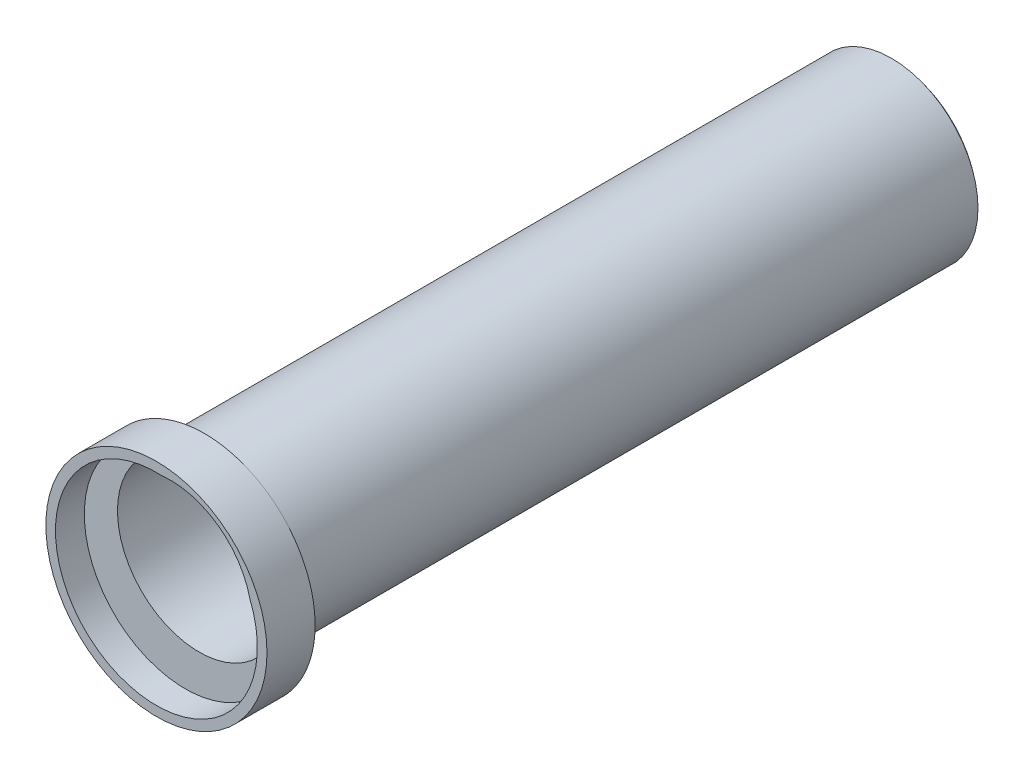
from build123d import *

# Parameters (mm, degrees)
SKETCH1_R           = 23
BOSS_EXTRUDE1_DEPTH = 10
SKETCH2_R           = 18
BOSS_EXTRUDE2_DEPTH = 140
SKETCH3_R           = 21
CUT_EXTRUDE1_DEPTH  = 6
SKETCH4_R           = 17
CUT_EXTRUDE2_DEPTH  = 143
CUT_EXTRUDE3_START  = 10
SKETCH5_R           = 17
CUT_EXTRUDE3_DEPTH  = 10


with BuildPart() as part:
    # Sketch1 → Boss-Extrude1 (new body)
    with BuildSketch(Plane.XY):
        Circle(SKETCH1_R)
    extrude(amount=BOSS_EXTRUDE1_DEPTH)

    # Sketch2 → Boss-Extrude2 (add)
    with BuildSketch(Plane(origin=(0, 0, 0), x_dir=(-1, 0, 0), z_dir=(0, 0, -1))):
        with Locations((-2.9, 4.07)):
            Circle(SKETCH2_R)
    extrude(amount=BOSS_EXTRUDE2_DEPTH)

    # Sketch3 → Cut-Extrude1 (cut)
    with BuildSketch(Plane.XY.offset(10)):
        Circle(SKETCH3_R)
    extrude(amount=-CUT_EXTRUDE1_DEPTH, mode=Mode.SUBTRACT)

    # Sketch4 → Cut-Extrude2 (cut)
    with BuildSketch(Plane.XY.offset(4)):
        with Locations((2.9, 4.07)):
            Circle(SKETCH4_R)
    extrude(amount=-CUT_EXTRUDE2_DEPTH, mode=Mode.SUBTRACT)

    # Sketch5 → Cut-Extrude3 (cut)
    with BuildSketch(Plane.XY.offset(4).offset(CUT_EXTRUDE3_START)):
        with Locations((2.9, 4.07)):
            Circle(SKETCH5_R)
    extrude(amount=-CUT_EXTRUDE3_DEPTH, mode=Mode.SUBTRACT)

    # Sketch6 → Revolve1 (revolve)
    with BuildSketch(Plane(origin=(0, 4.07, 0), x_dir=(1, 0, 0), z_dir=(0, 1, 0))):
        with BuildLine():
            Line((2.9, 142.921547381), (-7.1, 142.921547381))
            ThreePointArc((-7.1, 142.921547381), (-11.369159906, 142.197807517), (-15.1, 140))
            Line((-15.1, 140), (2.9, 140))
            Line((2.9, 140), (2.9, 142.921547381))
        make_face()
    revolve(axis=Axis((2.9, 4.07, -149.3931931), (0, 0, 1)))


solid = part.part
